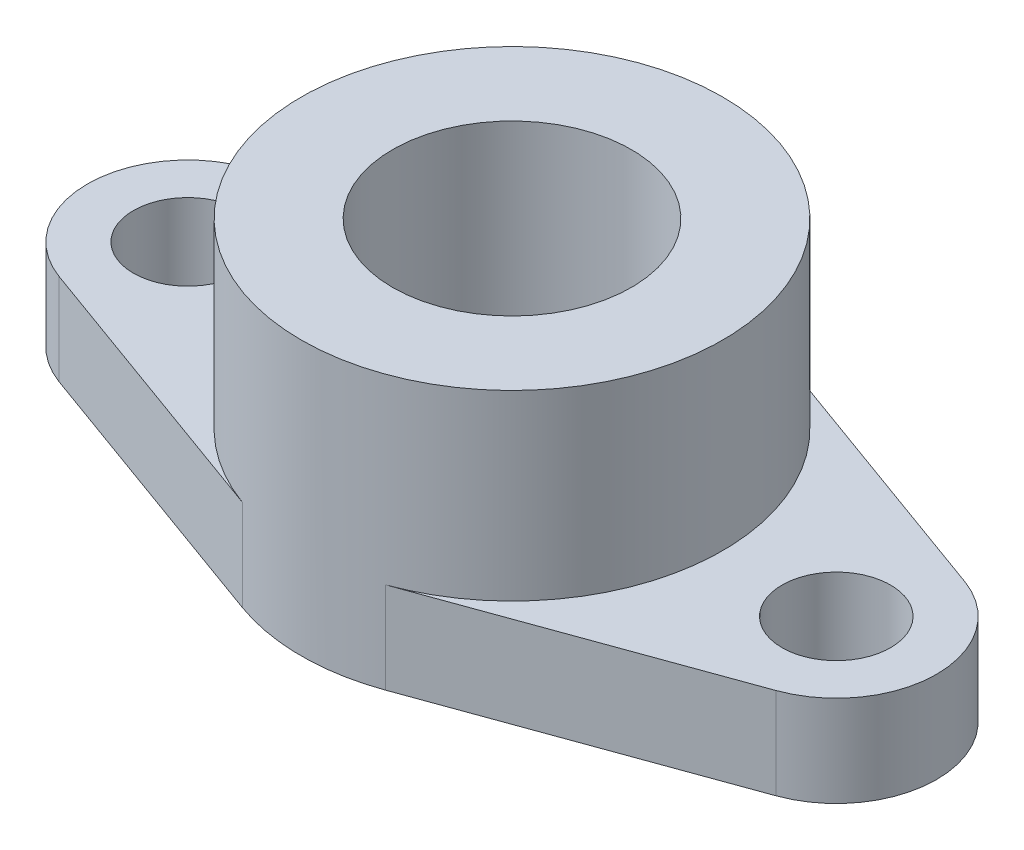
from build123d import *

# Parameters (mm, degrees)
SKETCH1_R           = 4.826
SKETCH1_R_2         = 2.9765625
BOSS_EXTRUDE1_DEPTH = 5
SKETCH2_R           = 11.548437406
SKETCH2_R_2         = 6.5484375
BOSS_EXTRUDE2_DEPTH = 10.000000066


with BuildPart() as part:
    # Sketch1 → Boss-Extrude1 (new body)
    with BuildSketch(Plane(origin=(0, 0, 0), x_dir=(1, 0, 0), z_dir=(0, 1, 0))):
        with BuildLine():
            Line((19.651001449, 5.171977776), (3.928571441, 10.859683833))
            ThreePointArc((3.928571441, 10.859683833), (0, 11.548437406), (-3.928571441, 10.859683833))
            Line((-3.928571441, 10.859683833), (-19.651001449, 5.171977776))
            ThreePointArc((-19.651001449, 5.171977776), (-23.280000049, 0), (-19.651001449, -5.171977776))
            Line((-19.651001449, -5.171977776), (-3.928571441, -10.859683833))
            ThreePointArc((-3.928571441, -10.859683833), (0, -11.548437406), (3.928571441, -10.859683833))
            Line((3.928571441, -10.859683833), (19.651001449, -5.171977776))
            ThreePointArc((19.651001449, -5.171977776), (23.280000049, 0), (19.651001449, 5.171977776))
        make_face()
        with Locations(Location((0, 0, 0), (0, 0, 270))):
            Circle(SKETCH1_R, mode=Mode.SUBTRACT)
        with Locations(Location((17.78, 0, 0), (0, 0, 270))):
            Circle(SKETCH1_R_2, mode=Mode.SUBTRACT)
        with Locations(Location((-17.78, 0, 0), (0, 0, 270))):
            Circle(SKETCH1_R_2, mode=Mode.SUBTRACT)
    extrude(amount=BOSS_EXTRUDE1_DEPTH)

    # Sketch2 → Boss-Extrude2 (add)
    with BuildSketch(Plane(origin=(0, 5, 0), x_dir=(1, 0, 0), z_dir=(0, 1, 0))):
        with Locations(Location((0, 0, 0), (0, 0, 109.887967665))):
            Circle(SKETCH2_R)
        with Locations(Location((0, 0, 0), (0, 0, 270))):
            Circle(SKETCH2_R_2, mode=Mode.SUBTRACT)
    extrude(amount=BOSS_EXTRUDE2_DEPTH)


solid = part.part
